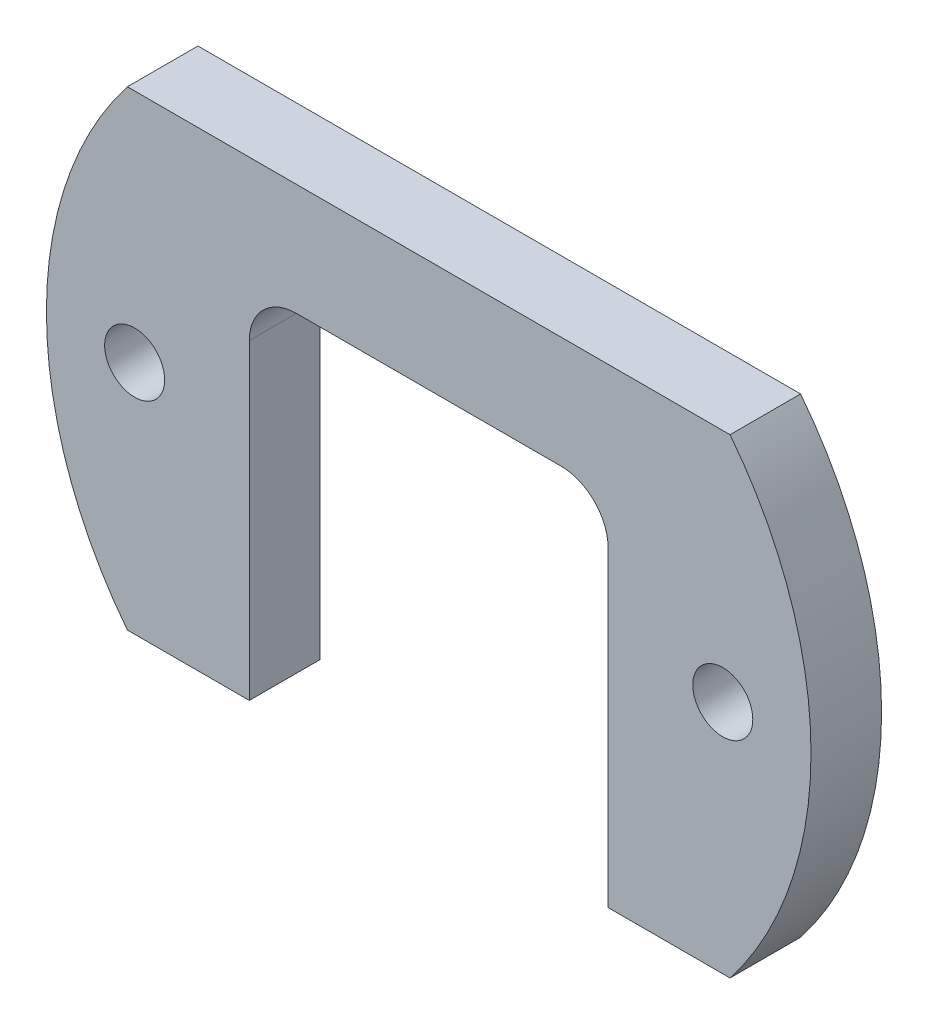
from build123d import *

# Parameters (mm, degrees)
EXTRUDE_1_DEPTH         = 12
HOLE_WIZARD_M12_2_D     = 10.2
HOLE_WIZARD_M12_2_DEPTH = 32.75
HOLE_WIZARD_M12_2_TIP   = 3.064389157
FILLET_2_R              = 8


with BuildPart() as part:
    # 草图1 → 凸台-拉伸1 (new body)
    with BuildSketch(Plane.XY):
        with BuildLine():
            Line((-30.5, 61), (30.5, 61))
            Line((30.5, 61), (30.5, 0))
            Line((30.5, 0), (51.23475383, 0))
            ThreePointArc((51.23475383, 0), (65, 40), (51.23475383, 80))
            Line((51.23475383, 80), (0, 80))
            Line((0, 80), (-51.23475383, 80))
            ThreePointArc((-51.23475383, 80), (-65, 40), (-51.23475383, 0))
            Line((-51.23475383, 0), (-30.5, 0))
            Line((-30.5, 0), (-30.5, 61))
        make_face()
    extrude(amount=EXTRUDE_1_DEPTH)

    # M12 螺纹孔2
    with Locations(Plane.XY.offset(12)):
        with Locations((-50, 40), (50, 40)):
            Hole(HOLE_WIZARD_M12_2_D / 2, depth=HOLE_WIZARD_M12_2_DEPTH)
            with Locations((0, 0, -(HOLE_WIZARD_M12_2_DEPTH + HOLE_WIZARD_M12_2_TIP / 2))):  # 118° drill point
                Cone(0, HOLE_WIZARD_M12_2_D / 2, HOLE_WIZARD_M12_2_TIP, mode=Mode.SUBTRACT)

    # 圆角2
    fillet_2_edges = [part.edges().sort_by_distance(p)[0] for p in [
        (30.5, 61, 6),
        (-30.5, 61, 6),
    ]]
    fillet(fillet_2_edges, radius=FILLET_2_R)


solid = part.part
